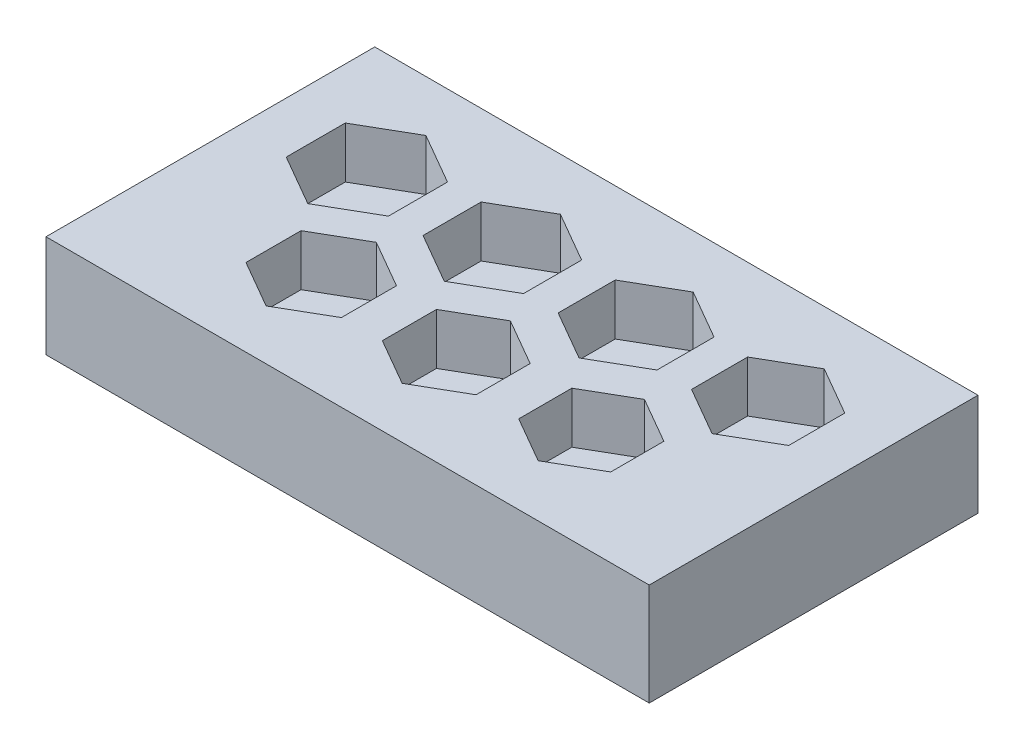
from build123d import *

# Parameters (mm, degrees)
SKETCH1_W           = 35.4
SKETCH1_H           = 19.293489948
BOSS_EXTRUDE1_DEPTH = 3
SKETCH1_2_W         = 35.4
SKETCH1_2_H         = 19.293489948
BOSS_EXTRUDE2_DEPTH = 3


with BuildPart() as part:
    # Sketch1 → Boss-Extrude1 (new body)
    with BuildSketch(Plane(origin=(0, 0, 0), x_dir=(1, 0, 0), z_dir=(0, 1, 0))):
        with Locations((-0.2, -3.182643359)):
            Rectangle(SKETCH1_W, SKETCH1_H)
        Polygon((-8.9, -1.732050808), (-8.9, 1.732050808), (-11.9, 3.464101615), (-14.9, 1.732050808), (-14.9, -1.732050808), (-11.9, -3.464101615), align=None, mode=Mode.SUBTRACT)
        Polygon((-1, -1.703183294), (-1, 1.703183294), (-3.95, 3.406366588), (-6.9, 1.703183294), (-6.9, -1.703183294), (-3.95, -3.406366588), align=None, mode=Mode.SUBTRACT)
        Polygon((6.8, -1.674315781), (6.8, 1.674315781), (3.9, 3.348631561), (1, 1.674315781), (1, -1.674315781), (3.9, -3.348631561), align=None, mode=Mode.SUBTRACT)
        Polygon((14.5, -1.645448267), (14.5, 1.645448267), (11.65, 3.290896534), (8.8, 1.645448267), (8.8, -1.645448267), (11.65, -3.290896534), align=None, mode=Mode.SUBTRACT)
        Polygon((-7.925, -3.420800345), (-10.725, -5.037381099), (-10.725, -8.270542606), (-7.925, -9.88712336), (-5.125, -8.270542606), (-5.125, -5.037381099), align=None, mode=Mode.SUBTRACT)
        Polygon((7.925, -3.536270399), (5.225, -5.095116126), (5.225, -8.212807579), (7.925, -9.771653306), (10.625, -8.212807579), (10.625, -5.095116126), align=None, mode=Mode.SUBTRACT)
        Polygon((0, -3.478535372), (-2.75, -5.066248612), (-2.75, -8.241675093), (0, -9.829388333), (2.75, -8.241675093), (2.75, -5.066248612), align=None, mode=Mode.SUBTRACT)
    extrude(amount=BOSS_EXTRUDE1_DEPTH)

    # Sketch1<2> → Boss-Extrude2 (add)
    with BuildSketch(Plane(origin=(0, 0, 0), x_dir=(1, 0, 0), z_dir=(0, 1, 0))):
        with Locations((-0.2, -3.182643359)):
            Rectangle(SKETCH1_2_W, SKETCH1_2_H)
    extrude(amount=-BOSS_EXTRUDE2_DEPTH)


solid = part.part
